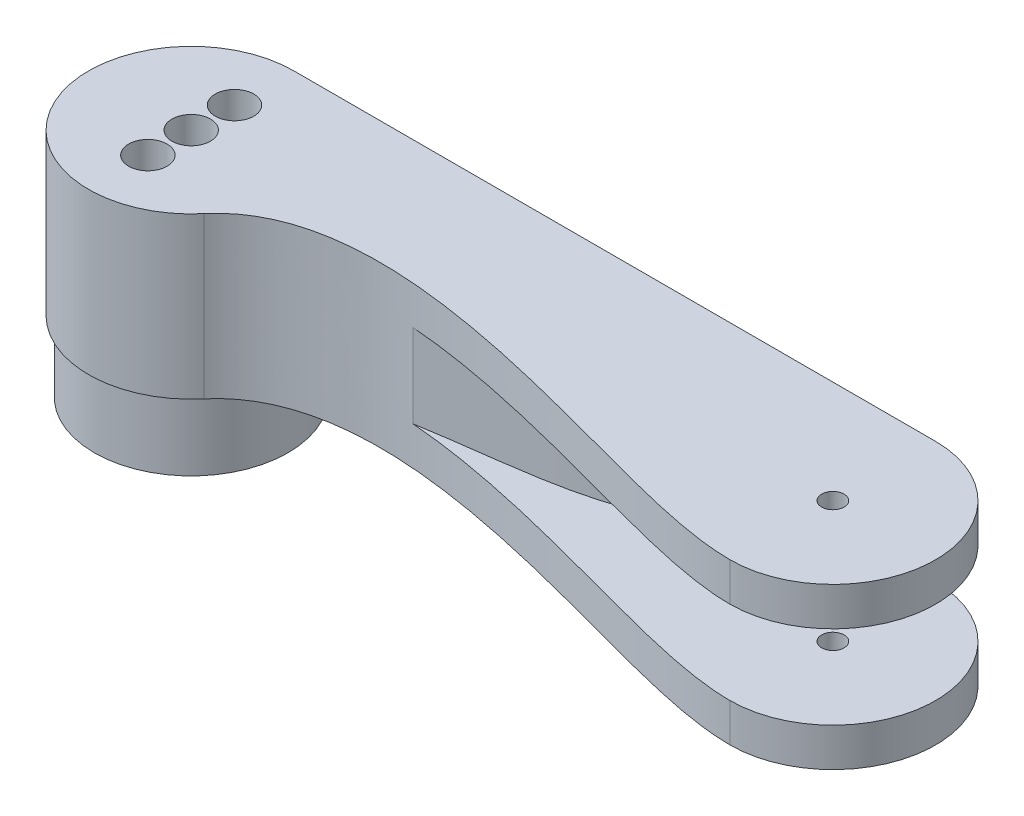
from build123d import *

# Parameters (mm, degrees)
BOSS_EXTRUDE1_DEPTH            = 6
SKETCH3_R                      = 1.75
CUT_EXTRUDE2_DEPTH             = 69.176242196
BOSS_EXTRUDE2_DEPTH            = 13
BOSS_EXTRUDE3_DEPTH            = 6
CUT_EXTRUDE3_REACH             = 74.367
SKETCH6_R                      = 1.75
CUT_EXTRUDE4_REACH             = 74.367
SKETCH8_R                      = 15.1
BOSS_EXTRUDE4_DEPTH            = 11
SKETCH9_R                      = 1.75
CUT_EXTRUDE5_DEPTH             = 10
CUT_EXTRUDE6_REACH             = 78.864
SKETCH11_R                     = 3
CUT_EXTRUDE6_DIRECTION_2_DEPTH = 77.863515556
CUT_EXTRUDE7_REACH             = 74.719
SKETCH12_R                     = 3


with BuildPart() as part:
    # Sketch1 → Boss-Extrude1 (new body)
    with BuildSketch(Plane(origin=(0, 0, 0), x_dir=(1, 0, 0), z_dir=(0, 1, 0))):
        with BuildLine():
            Line((-50, 16), (50, 16))
            ThreePointArc((50, 16), (66, 0), (50, -16))
            Line((50, -16), (-50, -16))
            ThreePointArc((-50, -16), (-66, 0), (-50, 16))
        make_face()
    extrude(amount=BOSS_EXTRUDE1_DEPTH)

    # Sketch3 → Cut-Extrude2 (cut, through all)
    with BuildSketch(Plane.XZ):
        with Locations(Location((50, 0, 0), (0, 0, 270))):
            Circle(SKETCH3_R)
    extrude(amount=-CUT_EXTRUDE2_DEPTH, mode=Mode.SUBTRACT)

    # Sketch4 → Boss-Extrude2 (add)
    with BuildSketch(Plane(origin=(0, 6, 0), x_dir=(1, 0, 0), z_dir=(0, 1, 0))):
        with BuildLine():
            Line((-50, 16), (30, 16))
            add(Edge.make_bspline(
                [(30, 16), (21.992860017, -10.862158013), (-23.676278326, 6.118145935), (-34.285676412, -16)],
                knots=[0, 0, 0, 0, 1, 1, 1, 1], degree=3))
            Line((-34.285676412, -16), (-50, -16))
            ThreePointArc((-50, -16), (-66, 0), (-50, 16))
        make_face()
    extrude(amount=BOSS_EXTRUDE2_DEPTH)

    # Sketch5 → Boss-Extrude3 (add)
    with BuildSketch(Plane(origin=(0, 19, 0), x_dir=(1, 0, 0), z_dir=(0, 1, 0))):
        with BuildLine():
            Line((-50, 16), (50, 16))
            ThreePointArc((50, 16), (66, 0), (50, -16))
            Line((50, -16), (-50, -16))
            ThreePointArc((-50, -16), (-66, 0), (-50, 16))
        make_face()
    extrude(amount=BOSS_EXTRUDE3_DEPTH)

    # Sketch6 → Cut-Extrude3 (cut, up to next)
    with BuildSketch(Plane(origin=(0, 25, 0), x_dir=(1, 0, 0), z_dir=(0, 1, 0)), mode=Mode.PRIVATE) as cut_extrude3_sk1:
        with Locations(Location((50, 0, 0), (0, 0, 90))):
            Circle(SKETCH6_R)
    cut_extrude3_tool1 = extrude(cut_extrude3_sk1.sketch, amount=-CUT_EXTRUDE3_REACH, mode=Mode.PRIVATE) & part.part
    add(cut_extrude3_tool1.solids().sort_by_distance((50, 25, 0))[0], mode=Mode.SUBTRACT)

    # Sketch7 → Cut-Extrude4 (cut, up to next)
    with BuildSketch(Plane(origin=(0, 25, 0), x_dir=(1, 0, 0), z_dir=(0, 1, 0)), mode=Mode.PRIVATE) as cut_extrude4_sk1:
        with BuildLine():
            ThreePointArc((-37.731263809, -10.270253759), (-43.22962557, -14.496966237), (-50, -16))
            Line((-50, -16), (50, -16))
            add(Edge.make_bspline(
                [(-37.731263809, -10.270253759), (-30.332556703, -1.431836739), (6.050402888, -3.364587973), (38.512231583, -16), (50, -16)],
                knots=[0, 0, 0, 0, 0.426660683, 1, 1, 1, 1], degree=3))
        make_face()
    cut_extrude4_tool1 = extrude(cut_extrude4_sk1.sketch, amount=-CUT_EXTRUDE4_REACH, mode=Mode.PRIVATE) & part.part
    add(cut_extrude4_tool1.solids().sort_by_distance((-6.915299, 25, 11.013102))[0], mode=Mode.SUBTRACT)

    # Sketch8 → Boss-Extrude4 (add)
    with BuildSketch(Plane.XZ):
        with Locations(Location((-50, 0, 0), (0, 0, 90))):
            Circle(SKETCH8_R)
    extrude(amount=BOSS_EXTRUDE4_DEPTH)

    # Sketch9 → Cut-Extrude5 (cut)
    with BuildSketch(Plane.XZ.offset(11)):
        with Locations(Location((-50, 6.75, 0), (0, 0, 270))):
            Circle(SKETCH9_R)
        with Locations(Location((-50, -6.75, 0), (0, 0, 270))):
            Circle(SKETCH9_R)
    extrude(amount=-CUT_EXTRUDE5_DEPTH, mode=Mode.SUBTRACT)

    # Sketch11 → Cut-Extrude6 (cut, up to next)
    with BuildSketch(Plane.XZ.offset(11), mode=Mode.PRIVATE) as cut_extrude6_sk1:
        with Locations(Location((-50, 0, 0), (0, 0, 90))):
            Circle(SKETCH11_R)
    cut_extrude6_tool1 = extrude(cut_extrude6_sk1.sketch, amount=-CUT_EXTRUDE6_REACH, mode=Mode.PRIVATE) & part.part
    add(cut_extrude6_tool1.solids().sort_by_distance((-50, -11, 0))[0], mode=Mode.SUBTRACT)

    # Sketch11 → Cut-Extrude6 direction 2 (cut)
    with BuildSketch(Plane.XZ.offset(11)):
        with Locations(Location((-50, 0, 0), (0, 0, 90))):
            Circle(SKETCH11_R)
    extrude(amount=CUT_EXTRUDE6_DIRECTION_2_DEPTH, mode=Mode.SUBTRACT)

    # Sketch12 → Cut-Extrude7 (cut, up to next)
    with BuildSketch(Plane.XZ.offset(1), mode=Mode.PRIVATE) as cut_extrude7_sk1:
        with Locations(Location((-50, 6.75, 0), (0, 0, 270))):
            Circle(SKETCH12_R)
    cut_extrude7_tool1 = extrude(cut_extrude7_sk1.sketch, amount=-CUT_EXTRUDE7_REACH, mode=Mode.PRIVATE) & part.part
    # Sketch12 → Cut-Extrude7 (cut, up to next)
    with BuildSketch(Plane.XZ.offset(1), mode=Mode.PRIVATE) as cut_extrude7_sk2:
        with Locations(Location((-50, -6.75, 0), (0, 0, 270))):
            Circle(SKETCH12_R)
    cut_extrude7_tool2 = extrude(cut_extrude7_sk2.sketch, amount=-CUT_EXTRUDE7_REACH, mode=Mode.PRIVATE) & part.part
    add(cut_extrude7_tool1.solids().sort_by_distance((-50, -1, 6.75))[0], mode=Mode.SUBTRACT)
    add(cut_extrude7_tool2.solids().sort_by_distance((-50, -1, -6.75))[0], mode=Mode.SUBTRACT)


solid = part.part
